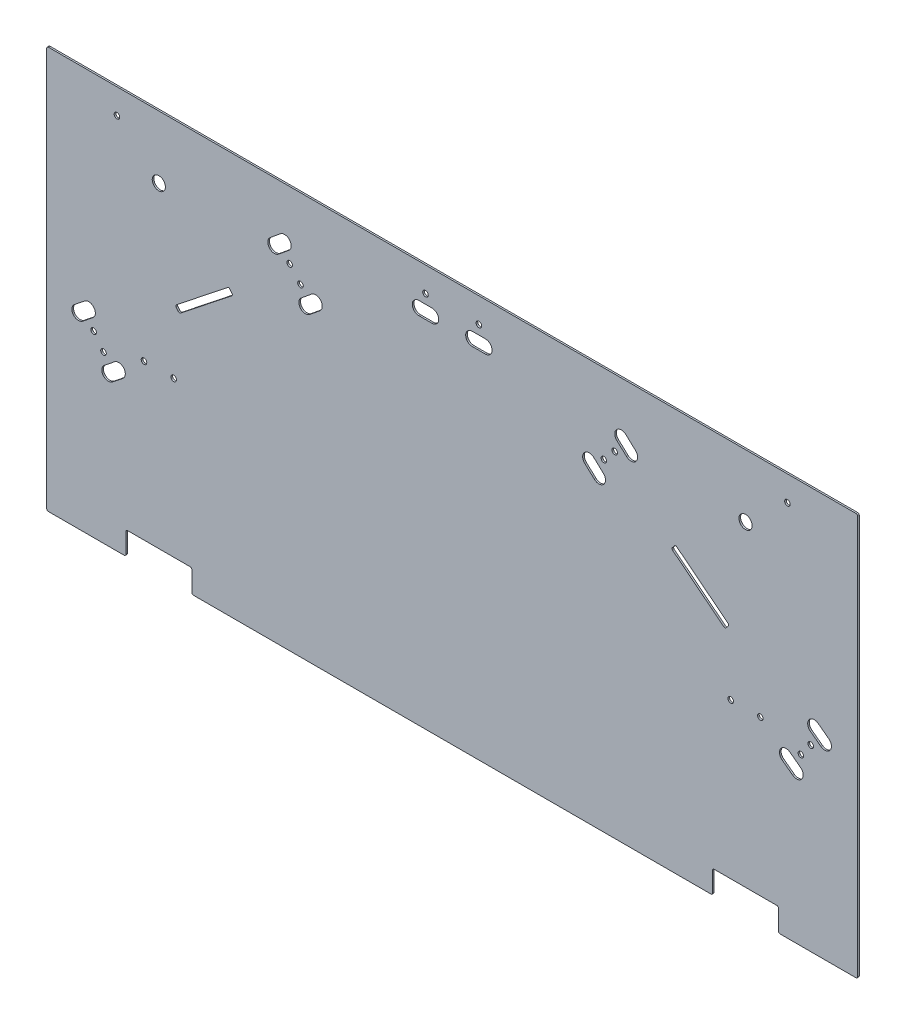
from build123d import *

# Parameters (mm, degrees)
SKETCH1_R              = 5.3578125
BOSS_EXTRUDE1_DEPTH    = 3.175
SKETCH2_R              = 5.3578125
CUT_EXTRUDE1_DEPTH     = 872.830950142
CUT_EXTRUDE2_DEPTH     = 872.830950142
FILLET1_R              = 3.175
F_1_1_DIAMETER_HOLE1_D = 25.4


with BuildPart() as part:
    # Sketch1 → Boss-Extrude1 (new body)
    with BuildSketch(Plane.XY):
        Polygon((781.05, 387.35), (-781.05, 387.35), (-781.05, -387.35), (-628.65, -387.35), (-628.65, -342.9), (-501.65, -342.9), (-501.65, -387.35), (501.65, -387.35), (501.65, -342.9), (628.65, -342.9), (628.65, -387.35), (781.05, -387.35), align=None)
        with Locations((-593.725, -44.45)):
            Circle(SKETCH1_R, mode=Mode.SUBTRACT)
        with Locations((-536.575, -44.45)):
            Circle(SKETCH1_R, mode=Mode.SUBTRACT)
        with Locations((536.575, -44.45)):
            Circle(SKETCH1_R, mode=Mode.SUBTRACT)
        with Locations((593.725, -44.45)):
            Circle(SKETCH1_R, mode=Mode.SUBTRACT)
        Polygon((-525.741660624, 69.011766046), (-533.633373454, 78.962186571), (-430.149, 161.036), (-422.25728717, 151.085579476), align=None, mode=Mode.SUBTRACT)
        with Locations((-645.795, 339.09)):
            Circle(SKETCH1_R, mode=Mode.SUBTRACT)
        with Locations((-51.435, 339.459169182)):
            Circle(SKETCH1_R, mode=Mode.SUBTRACT)
        Polygon((533.712268362, 79.061761082), (525.830130005, 69.103754509), (422.266861643, 151.077993427), (430.149, 161.036), align=None, mode=Mode.SUBTRACT)
        with Locations((51.435, 339.338450694)):
            Circle(SKETCH1_R, mode=Mode.SUBTRACT)
        with Locations((645.795, 339.09)):
            Circle(SKETCH1_R, mode=Mode.SUBTRACT)
    extrude(amount=BOSS_EXTRUDE1_DEPTH)

    # Sketch2 → Cut-Extrude1 (cut, through all)
    with BuildSketch(Plane.XY.offset(3.175)):
        with Locations((-313.055, 258.318)):
            Circle(SKETCH2_R)
        with Locations((-292.227, 234.354341765)):
            Circle(SKETCH2_R)
        with Locations((-690.753, -42.672)):
            Circle(SKETCH2_R)
        with Locations((-671.703, -68.072)):
            Circle(SKETCH2_R)
        with Locations((292.227, 234.354341765)):
            Circle(SKETCH2_R)
        with Locations((313.055, 258.318)):
            Circle(SKETCH2_R)
        with Locations((690.753, -42.672)):
            Circle(SKETCH2_R)
        with Locations((671.703, -68.072)):
            Circle(SKETCH2_R)
    extrude(amount=-CUT_EXTRUDE1_DEPTH, mode=Mode.SUBTRACT)

    # Sketch3 → Cut-Extrude2 (cut, through all)
    with BuildSketch(Plane.XY.offset(3.175)):
        with BuildLine():
            Line((-64.135, 321.679169182), (-38.735, 321.679169182))
            ThreePointArc((-38.735, 321.679169182), (-26.035, 308.979169182), (-38.735, 296.279169182))
            Line((-38.735, 296.279169182), (-64.135, 296.279169182))
            ThreePointArc((-64.135, 296.279169182), (-76.835, 308.979169182), (-64.135, 321.679169182))
        make_face()
        with BuildLine():
            Line((38.735, 321.679169182), (64.135, 321.679169182))
            ThreePointArc((64.135, 321.679169182), (76.835, 308.979169182), (64.135, 296.279169182))
            Line((64.135, 296.279169182), (38.735, 296.279169182))
            ThreePointArc((38.735, 296.279169182), (26.035, 308.979169182), (38.735, 321.679169182))
        make_face()
        with BuildLine():
            Line((-350.556019335, 283.378351904), (-330.943397226, 299.518520862))
            ThreePointArc((-330.943397226, 299.518520862), (-313.067001693, 297.782294287), (-314.803228268, 279.905898753))
            Line((-314.803228268, 279.905898753), (-334.415850377, 263.765729795))
            ThreePointArc((-334.415850377, 263.765729795), (-352.292245911, 265.50195637), (-350.556019335, 283.378351904))
        make_face()
        with BuildLine():
            Line((-290.735192784, 212.55542181), (-271.122570675, 228.695590768))
            ThreePointArc((-271.122570675, 228.695590768), (-253.246175141, 226.959364193), (-254.982401716, 209.082968659))
            Line((-254.982401716, 209.082968659), (-274.595023825, 192.9427997))
            ThreePointArc((-274.595023825, 192.9427997), (-292.471419359, 194.679026276), (-290.735192784, 212.55542181))
        make_face()
        with BuildLine():
            Line((-727.880738371, -17.075495686), (-708.045418559, -1.20980667))
            ThreePointArc((-708.045418559, -1.20980667), (-690.194914145, -3.194622068), (-692.179729543, -21.045126482))
            Line((-692.179729543, -21.045126482), (-712.015049355, -36.910815498))
            ThreePointArc((-712.015049355, -36.910815498), (-729.865553769, -34.9260001), (-727.880738371, -17.075495686))
        make_face()
        with BuildLine():
            Line((-670.202475675, -89.639847242), (-650.367155863, -73.774158225))
            ThreePointArc((-650.367155863, -73.774158225), (-632.516651449, -75.758973623), (-634.501466846, -93.609478037))
            Line((-634.501466846, -93.609478037), (-654.336786658, -109.475167053))
            ThreePointArc((-654.336786658, -109.475167053), (-672.187291072, -107.490351656), (-670.202475675, -89.639847242))
        make_face()
        with BuildLine():
            Line((334.54998107, 297.254089706), (353.197796006, 280.008249683))
            ThreePointArc((353.197796006, 280.008249683), (353.898783462, 262.061422203), (335.951955982, 261.360434746))
            Line((335.951955982, 261.360434746), (317.304141046, 278.60627477))
            ThreePointArc((317.304141046, 278.60627477), (316.60315359, 296.553102249), (334.54998107, 297.254089706))
        make_face()
        with BuildLine():
            Line((272.680669675, 228.213187181), (291.328484611, 210.967347158))
            ThreePointArc((291.328484611, 210.967347158), (292.029472067, 193.020519678), (274.082644588, 192.319532222))
            Line((274.082644588, 192.319532222), (255.434829652, 209.565372245))
            ThreePointArc((255.434829652, 209.565372245), (254.733842195, 227.512199725), (272.680669675, 228.213187181))
        make_face()
        with BuildLine():
            Line((650.872852602, -74.669223611), (671.187893449, -89.915833575))
            ThreePointArc((671.187893449, -89.915833575), (673.722108891, -107.69665898), (655.941283485, -110.230874422))
            Line((655.941283485, -110.230874422), (635.626242638, -94.984264458))
            ThreePointArc((635.626242638, -94.984264458), (633.092027197, -77.203439053), (650.872852602, -74.669223611))
        make_face()
        with BuildLine():
            Line((705.207416511, 0.46801413), (725.522457358, -14.778595833))
            ThreePointArc((725.522457358, -14.778595833), (728.0566728, -32.559421239), (710.275847395, -35.09363668))
            Line((710.275847395, -35.09363668), (689.960806548, -19.847026717))
            ThreePointArc((689.960806548, -19.847026717), (687.426591106, -2.066201311), (705.207416511, 0.46801413))
        make_face()
    extrude(amount=-CUT_EXTRUDE2_DEPTH, mode=Mode.SUBTRACT)

    # Fillet1
    fillet1_edges = [part.edges().sort_by_distance(p)[0] for p in [
        (430.149, 161.036, 1.5875),
        (422.266861643, 151.077993427, 1.5875),
        (525.830130005, 69.103754509, 1.5875),
        (533.712268362, 79.061761082, 1.5875),
        (-501.65, -387.35, 1.5875),
        (-501.65, -342.9, 1.5875),
        (-628.65, -342.9, 1.5875),
        (-628.65, -387.35, 1.5875),
        (-781.05, -387.35, 1.5875),
        (-781.05, 387.35, 1.5875),
        (781.05, 387.35, 1.5875),
        (781.05, -387.35, 1.5875),
        (628.65, -387.35, 1.5875),
        (628.65, -342.9, 1.5875),
        (501.65, -342.9, 1.5875),
        (501.65, -387.35, 1.5875),
        (-533.633373454, 78.962186571, 1.5875),
        (-525.741660624, 69.011766046, 1.5875),
        (-422.25728717, 151.085579476, 1.5875),
        (-430.149, 161.036, 1.5875),
    ]]
    fillet(fillet1_edges, radius=FILLET1_R)

    # 1 (1) Diameter Hole1 (through all)
    with Locations(Plane.XY.offset(3.175)):
        with Locations((-565.15, 266.7), (565.15, 266.7)):
            Hole(F_1_1_DIAMETER_HOLE1_D / 2)


solid = part.part
